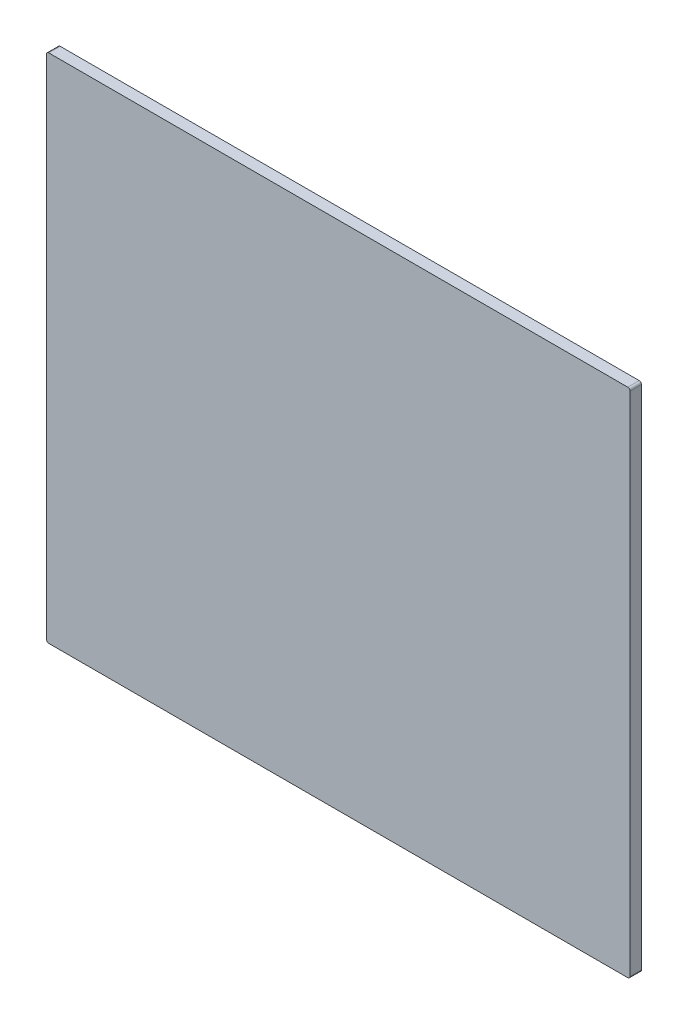
from build123d import *

# Parameters (mm, degrees)
SKETCH1_W           = 647.7
SKETCH1_H           = 567.69
BOSS_EXTRUDE1_DEPTH = 12.7
FILLET1_R           = 2.54


with BuildPart() as part:
    # Sketch1 → Boss-Extrude1 (new body)
    with BuildSketch(Plane.XY):
        with Locations((98.873295573, -23.118597285)):
            Rectangle(SKETCH1_W, SKETCH1_H)
    extrude(amount=BOSS_EXTRUDE1_DEPTH)

    # Fillet1
    fillet1_edges = [part.edges().sort_by_distance(p)[0] for p in [
        (-224.976704427, 260.726402715, 6.35),
        (-224.976704427, -306.963597285, 6.35),
        (422.723295573, -306.963597285, 6.35),
        (422.723295573, 260.726402715, 6.35),
    ]]
    fillet(fillet1_edges, radius=FILLET1_R)


solid = part.part
